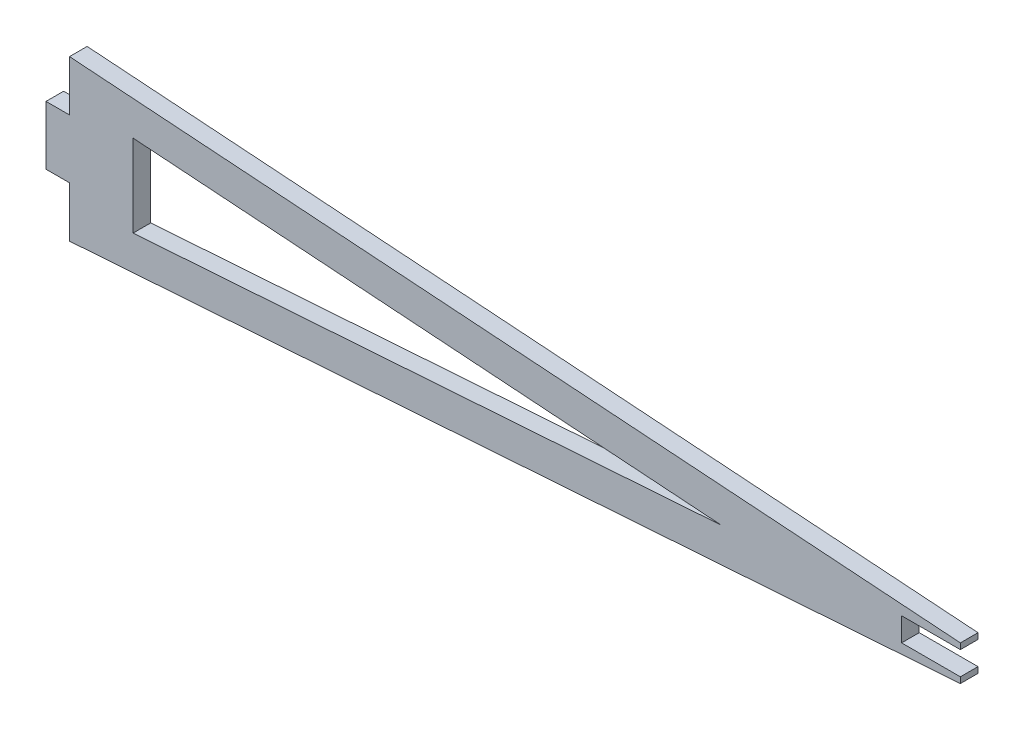
from build123d import *

# Parameters (mm, degrees)
EXTRUDE_1_DEPTH = 1.5


with BuildPart() as part:
    # Model → 凸台-拉伸1 (new body)
    with BuildSketch(Plane.XY):
        Polygon((18.441185759, 12.001049365), (20.44187601, 12.001049365), (20.44187601, 7.701049365), (96.23540717, 13.001049365), (96.23540717, 13.501049365), (91.23540717, 13.501049365), (91.23540717, 15.501049365), (96.235406774, 15.501049365), (96.235406378, 16.001049365), (20.44187601, 21.301049309), (20.441185759, 17.001049365), (18.441185759, 17.001049365), align=None)
        Polygon((25.850613074, 11.001049365), (25.850613074, 18.001049365), (75.902944972, 14.501049365), align=None, mode=Mode.SUBTRACT)
    extrude(amount=EXTRUDE_1_DEPTH)


solid = part.part
